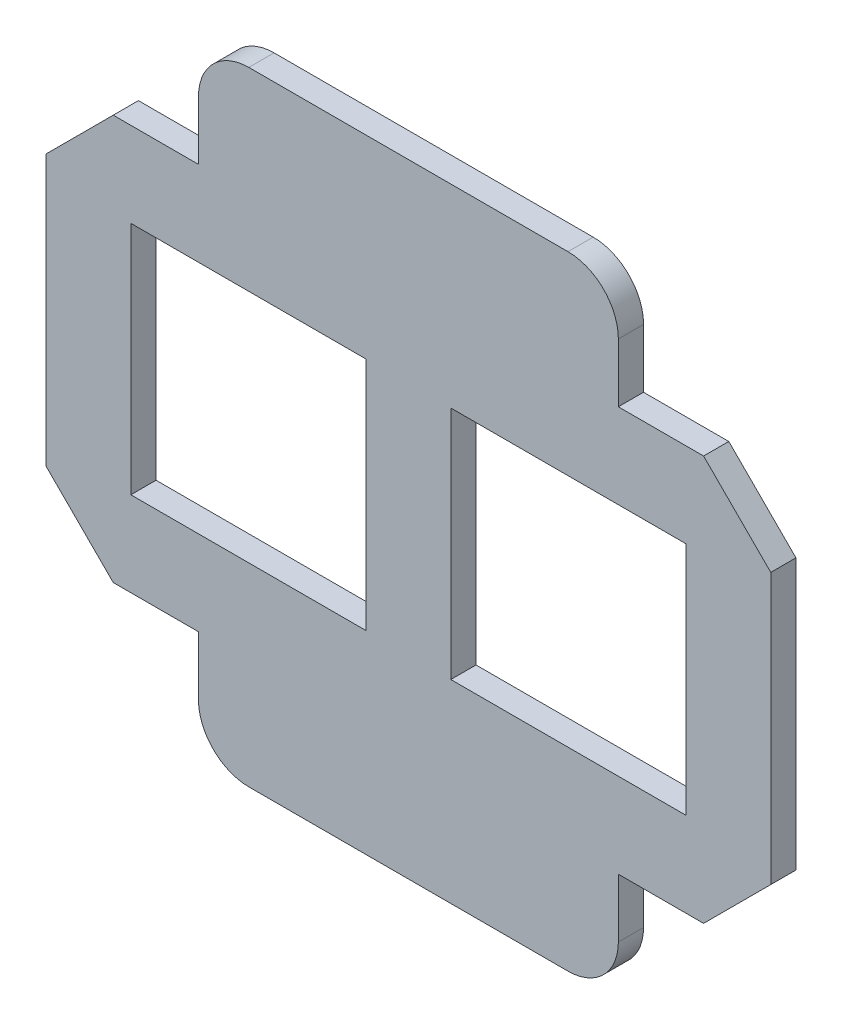
from build123d import *

# Parameters (mm, degrees)
SKETCH1_W           = 25
SKETCH1_H           = 6.5
SKETCH1_W_2         = 43.15
SKETCH1_H_2         = 24.1
SKETCH1_W_3         = 14
SKETCH1_H_3         = 14
BOSS_EXTRUDE1_DEPTH = 1.5
FILLET1_R           = 3
CHAMFER1_SIZE       = 4


with BuildPart() as part:
    # Sketch1 → Boss-Extrude1 (new body)
    # profile 1 of 3: a face of its own
    with BuildSketch(Plane.XY):
        with Locations((16.525, 22.3)):
            Rectangle(SKETCH1_W, SKETCH1_H)
    # profile 2 of 3: a face of its own
    with BuildSketch(Plane.XY):
        with Locations((16.525, 7)):
            Rectangle(SKETCH1_W_2, SKETCH1_H_2)
        with Locations((26.05, 7)):
            Rectangle(SKETCH1_W_3, SKETCH1_H_3, mode=Mode.SUBTRACT)
        with Locations((7, 7)):
            Rectangle(SKETCH1_W_3, SKETCH1_H_3, mode=Mode.SUBTRACT)
    # profile 3 of 3: a face of its own
    with BuildSketch(Plane.XY):
        with Locations((16.525, -8.3)):
            Rectangle(SKETCH1_W, SKETCH1_H)
    extrude(amount=BOSS_EXTRUDE1_DEPTH)

    # Fillet1
    fillet1_edges = [part.edges().sort_by_distance(p)[0] for p in [
        (29.025, -11.55, 0.75),
        (4.025, -11.55, 0.75),
        (4.025, 25.55, 0.75),
        (29.025, 25.55, 0.75),
    ]]
    fillet(fillet1_edges, radius=FILLET1_R)

    # Chamfer1
    chamfer1_edges = [part.edges().sort_by_distance(p)[0] for p in [
        (38.1, 19.05, 0.75),
        (38.1, -5.05, 0.75),
        (-5.05, -5.05, 0.75),
        (-5.05, 19.05, 0.75),
    ]]
    chamfer(chamfer1_edges, length=CHAMFER1_SIZE)


solid = part.part
